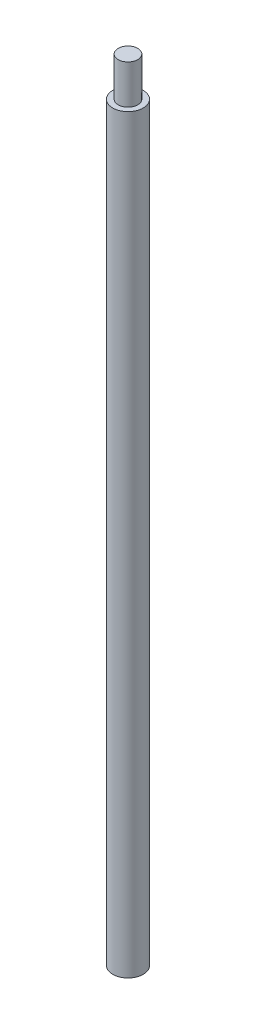
from build123d import *

# Parameters (mm, degrees)
SKETCH1_R           = 4.675
BOSS_EXTRUDE1_DEPTH = 230
SKETCH2_R           = 3
BOSS_EXTRUDE2_DEPTH = 12


with BuildPart() as part:
    # Sketch1 → Boss-Extrude1 (new body)
    with BuildSketch(Plane(origin=(0, 0, 0), x_dir=(1, 0, 0), z_dir=(0, 1, 0))):
        with Locations(Location((0, 0, 0), (0, 0, 270))):
            Circle(SKETCH1_R)
    extrude(amount=BOSS_EXTRUDE1_DEPTH)

    # Sketch2 → Boss-Extrude2 (add)
    with BuildSketch(Plane(origin=(0, 230, 0), x_dir=(1, 0, 0), z_dir=(0, 1, 0))):
        with Locations(Location((0, 0, 0), (0, 0, 270))):
            Circle(SKETCH2_R)
    extrude(amount=BOSS_EXTRUDE2_DEPTH)


solid = part.part
